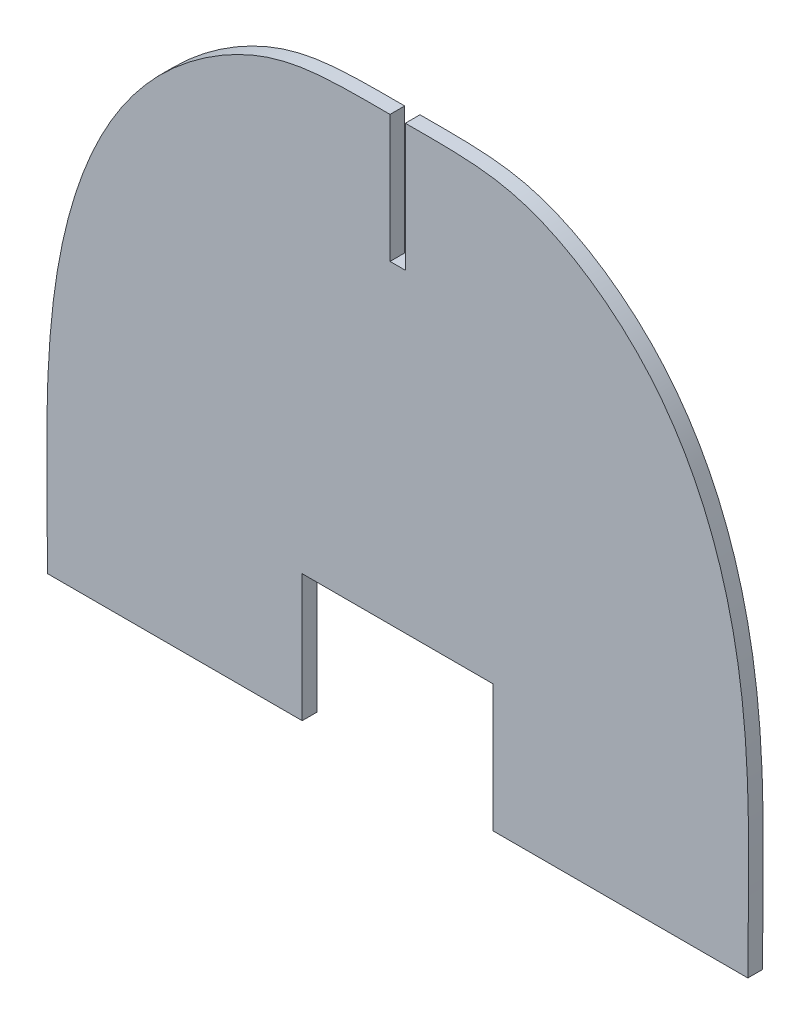
from build123d import *

# Parameters (mm, degrees)
BOSS_EXTRUDE1_DEPTH = 5.842
SKETCH3_W           = 38.1
SKETCH3_H           = 50.8
CUT_EXTRUDE1_DEPTH  = 302.290506827


with BuildPart() as part:
    # Sketch2 → Boss-Extrude1 (new body)
    with BuildSketch(Plane.XY):
        with BuildLine():
            Line((139.7, 39.6875), (0, 39.6875))
            Line((0, 39.6875), (0, 266.7))
            add(Edge.make_bspline(
                [(0, 266.7), (21.213326152, 266.7), (50.246788725, 267.616547831), (111.185848272, 228.593704445), (143.597858606, 144.621704947), (139.7, 75.222272686), (139.7, 39.6875)],
                knots=[0, 0, 0, 0, 0.165367143, 0.333681411, 0.645927816, 1, 1, 1, 1], degree=3))
        make_face()
    extrude(amount=BOSS_EXTRUDE1_DEPTH)

    # Sketch3 → Cut-Extrude1 (cut, through all)
    with BuildSketch(Plane.XY.offset(5.842)):
        Polygon((0, 266.7), (0, 268.866877319), (3.048, 268.866877319), (3.048, 215.9), (0, 215.9), align=None)
        with Locations((19.05, 65.0875)):
            Rectangle(SKETCH3_W, SKETCH3_H)
    extrude(amount=-CUT_EXTRUDE1_DEPTH, mode=Mode.SUBTRACT)

    # Mirror1: part across plane


with BuildPart() as part_1:
    add(part.part)
    add(part.part.mirror(Plane(origin=(0, 0, 0), x_dir=(0, 0, 1), z_dir=(1, 0, 0))))


solid = part_1.part
